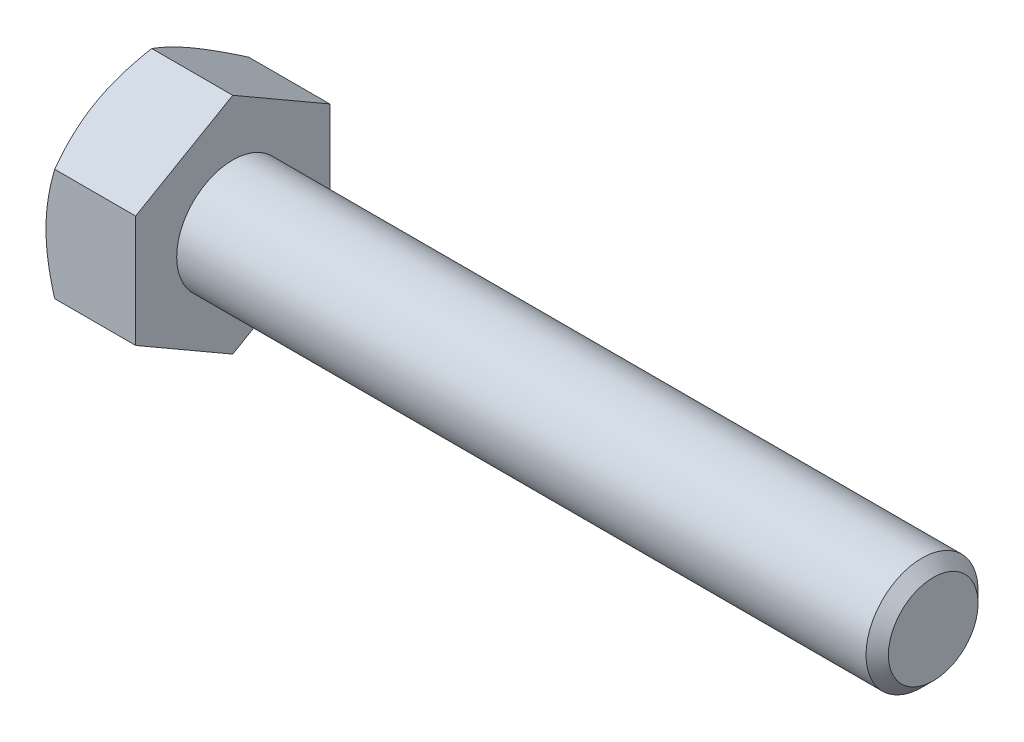
from build123d import *

# Parameters (mm, degrees)
BOSS_EXTRUDE1_DEPTH = 19.2
SKETCH2_R           = 12
BOSS_EXTRUDE2_DEPTH = 150
SKETCH3_OUTSIDE_W   = 146.226
SKETCH3_OUTSIDE_H   = 152.656
SKETCH3_OUTSIDE_R   = 20.784609691
CUT_EXTRUDE1_DEPTH  = 19.2
CUT_EXTRUDE1_DRAFT  = -60
CHAMFER1_SIZE       = 2.4


with BuildPart() as part:
    # Sketch1 → Boss-Extrude1 (new body)
    with BuildSketch(Plane(origin=(0, 0, 0), x_dir=(0, 0, -1), z_dir=(1, 0, 0))):
        Polygon((20.784609691, -12), (20.784609691, 12), (0, 24), (-20.784609691, 12), (-20.784609691, -12), (0, -24), align=None)
    extrude(amount=BOSS_EXTRUDE1_DEPTH)

    # Sketch2 → Boss-Extrude2 (add)
    with BuildSketch(Plane(origin=(19.2, 0, 0), x_dir=(0, 0, -1), z_dir=(1, 0, 0))):
        Circle(SKETCH2_R)
    extrude(amount=BOSS_EXTRUDE2_DEPTH)


with BuildPart() as cut_extrude1_tool:
    # Sketch3 outside → Cut-Extrude1 (with draft: the straight prism first)
    with BuildSketch(Plane.ZY):
        Rectangle(SKETCH3_OUTSIDE_W, SKETCH3_OUTSIDE_H)
        Circle(SKETCH3_OUTSIDE_R, mode=Mode.SUBTRACT)
    extrude(amount=-CUT_EXTRUDE1_DEPTH)
    # Cut-Extrude1: the draft: its side faces are tilted about the plane it starts from
    cut_extrude1_sides = [cut_extrude1_tool.faces().sort_by_distance(p)[0] for p in [
        (9.6, -76.328, 0),
        (9.6, 0, 73.113),
        (9.6, 76.328, 0),
        (9.6, 0, -73.113),
        (9.6, 0, -20.784609691),
    ]]
    draft(cut_extrude1_sides, Plane.ZY, CUT_EXTRUDE1_DRAFT)


with BuildPart() as part_1:
    add(part.part)

    # Cut-Extrude1: cut by cut_extrude1_tool
    add(cut_extrude1_tool.part, mode=Mode.SUBTRACT)

    # Chamfer1
    chamfer1_edges = [part_1.edges().sort_by_distance(p)[0] for p in [
        (169.2, 0, 12),
    ]]
    chamfer(chamfer1_edges, length=CHAMFER1_SIZE)


solid = part_1.part
